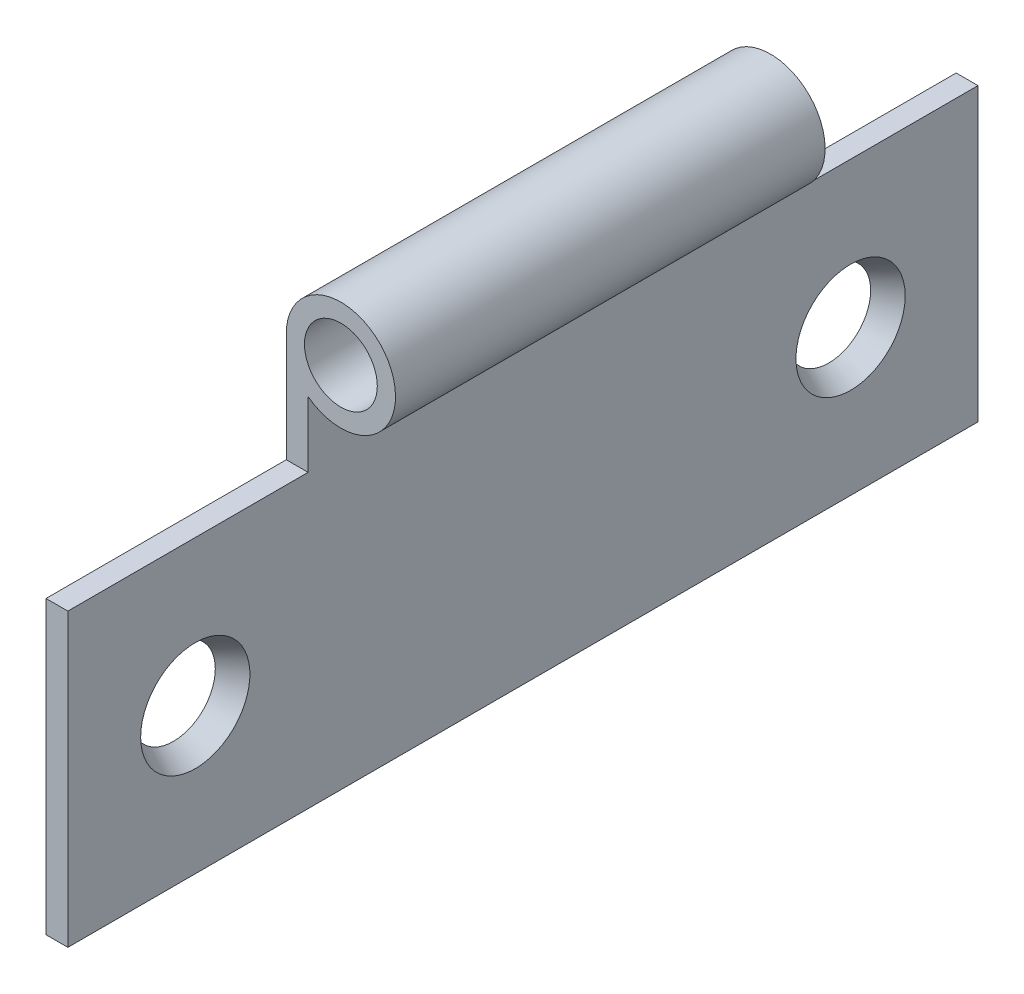
from build123d import *

# Parameters (mm, degrees)
SKETCH_1_W          = 0.6
SKETCH_1_H          = 11
EXTRUDE_1_DEPTH     = 12.5
SKETCH_2_R          = 1.5
SKETCH_3_R          = 1
CUT_EXTRUDE_1_DEPTH = 29.111385594
SKETCH_10_W         = 7.870368163
SKETCH_10_H         = 6
CUT_EXTRUDE_4_DEPTH = 60
SKETCH_12_R         = 1.15
SKETCH_11_R         = 1.5


with BuildPart() as part:
    # 草图1 → 拉伸-薄壁1 (new, symmetric)
    with BuildSketch(Plane.XY):
        with Locations((0.3, 5.5)):
            Rectangle(SKETCH_1_W, SKETCH_1_H)
    extrude(amount=EXTRUDE_1_DEPTH, both=True)

    # 扫描1: sweep along a curve in space
    with BuildLine() as sweep_1_path:
        Line((0.6, 11, 12.5), (0.6, 11, -12.5))
    # 草图2 → 扫描1 (sweep)
    with BuildSketch(Plane.XY.offset(12.5)):
        with Locations((1.5, 11)):
            Circle(SKETCH_2_R)
    sweep(path=sweep_1_path.line)

    # 草图3 → 切除-拉伸1 (cut, through all)
    with BuildSketch(Plane.XY.offset(12.5)):
        with Locations((1.5, 11)):
            Circle(SKETCH_3_R)
    extrude(amount=-CUT_EXTRUDE_1_DEPTH, mode=Mode.SUBTRACT)

    # 草图10 → 切除-拉伸4 (cut, symmetric)
    with BuildSketch(Plane(origin=(0.6, 0, 0), x_dir=(0, 0, -1), z_dir=(1, 0, 0))):
        with Locations((-9.835184081, 11)):
            Rectangle(SKETCH_10_W, SKETCH_10_H)
        with Locations((9.835184081, 11)):
            Rectangle(SKETCH_10_W, SKETCH_10_H)
    extrude(amount=CUT_EXTRUDE_4_DEPTH, both=True, mode=Mode.SUBTRACT)

    # 草图12 → 切除-放样1 section 0
    with BuildSketch(Plane.ZY):
        with Locations((-9, 4)):
            Circle(SKETCH_12_R)
    # 草图11 → 切除-放样1 section 1
    with BuildSketch(Plane(origin=(0.6, 0, 0), x_dir=(0, 0, -1), z_dir=(1, 0, 0))):
        with Locations((9, 4)):
            Circle(SKETCH_11_R)
    loft_1 = loft(mode=Mode.SUBTRACT)

    # 镜向1: 切除-放样1 across plane
    add(loft_1.mirror(Plane.XY), mode=Mode.SUBTRACT)


solid = part.part
